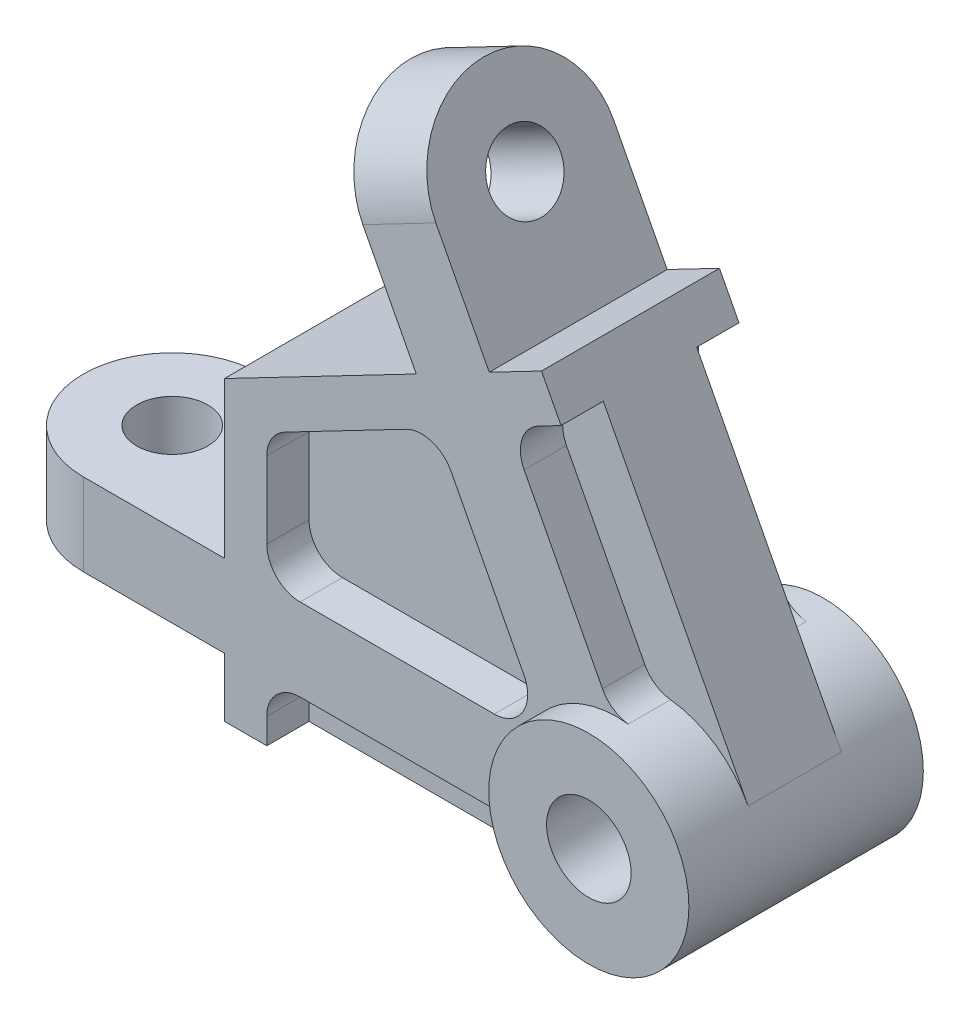
from build123d import *
from build123d.topology import SkipClean

# Parameters (mm, degrees)
BOSS_EXTRU_1_DEPTH      = 20
BOSS_EXTRU_2_DEPTH      = 26.35
BOSS_EXTRU_2_DEPTH_BACK = 26.35
ESQUISSE2_5_R           = 22.5
ESQUISSE2_5_R_2         = 9.5
BOSS_EXTRU_3_DEPTH      = 18.5
BOSS_EXTRU_4_DEPTH      = 18.5
ESQUISSE5_R             = 8
ENL_V_MAT_EXTRU_1_DEPTH = 188.483465609
ESQUISSE6_R             = 8
ENL_V_MAT_EXTRU_2_DEPTH = 190.711724403
ENL_V_START             = -9.5
ENL_V_MAT_EXTRU_3_DEPTH = 9.5


with BuildPart() as part:
    # Esquisse2 → Boss.-Extru.1 (new, symmetric)
    with BuildSketch(Plane.XY):
        with BuildLine():
            Line((-88.25, -22.5), (0, -22.5))
            ThreePointArc((0, -22.5), (-19.23551709, 11.672398309), (19.957743747, 10.389343798))
            Line((19.957743747, 10.389343798), (-16.981934979, 81.349806406))
            Line((-16.981934979, 81.349806406), (-28.734828519, 75.231637281))
            Line((-28.734828519, 75.231637281), (-40.740502796, 98.294322989))
            Line((-40.740502796, 98.294322989), (-57.15020321, 89.751973644))
            Line((-57.15020321, 89.751973644), (-45.144528933, 66.689287936))
            Line((-45.144528933, 66.689287936), (-88.25, 44.25))
            Line((-88.25, 44.25), (-88.25, 9.25))
            Line((-88.25, 9.25), (-120, 9.25))
            Line((-120, 9.25), (-120, -9.25))
            Line((-120, -9.25), (-88.25, -9.25))
            Line((-88.25, -9.25), (-88.25, -22.5))
        make_face()
    extrude(amount=BOSS_EXTRU_1_DEPTH, both=True)

    # Esquisse2<5> → Boss.-Extru.2 (add, two sides: drawn at the far end of the back side and taken through both)
    with BuildSketch(Plane.XY.offset(-BOSS_EXTRU_2_DEPTH_BACK)):
        Circle(ESQUISSE2_5_R)
        Circle(ESQUISSE2_5_R_2, mode=Mode.SUBTRACT)
    extrude(amount=BOSS_EXTRU_2_DEPTH + BOSS_EXTRU_2_DEPTH_BACK)

    # Esquisse3 → Boss.-Extru.3 (add)
    with BuildSketch(Plane.XZ.offset(9.25)):
        with BuildLine():
            Line((-120, 20), (-120, -20))
            ThreePointArc((-120, -20), (-140, 0), (-120, 20))
        make_face()
    extrude(amount=-BOSS_EXTRU_3_DEPTH)

    # Esquisse4 → Boss.-Extru.4 (add)
    with BuildSketch(Plane(origin=(8.204850207, 4.271174672, 0), x_dir=(0, 0, -1), z_dir=(0.8870108331782227, 0.46174861323503186, 0))):
        with BuildLine():
            Line((-20, 106), (20, 106))
            ThreePointArc((20, 106), (0, 126), (-20, 106))
        make_face()
    extrude(amount=-BOSS_EXTRU_4_DEPTH)

    # Esquisse5 → Enlèv. mat.-Extru.1 (cut, through all)
    with BuildSketch(Plane(origin=(8.204850207, 4.271174672, 0), x_dir=(0, 0, -1), z_dir=(0.8870108331782227, 0.46174861323503186, 0))):
        with Locations(Location((0, 106, 0), (0, 0, 90))):
            Circle(ESQUISSE5_R)
    extrude(amount=-ENL_V_MAT_EXTRU_1_DEPTH, mode=Mode.SUBTRACT)

    # Esquisse6 → Enlèv. mat.-Extru.2 (cut, through all)
    with BuildSketch(Plane.XZ.offset(9.25)):
        with Locations((-120, 0)):
            Circle(ESQUISSE6_R)
    extrude(amount=-ENL_V_MAT_EXTRU_2_DEPTH, mode=Mode.SUBTRACT)

    # Esquisse7 → Enlèv. mat.-Extru.3 (cut)
    with SkipClean():  # the faces are left unmerged after this step: merging them gives an invalid solid
        with BuildSketch(Plane.XY.offset(20).offset(ENL_V_START)):
            with BuildLine():
                Line((-17.695635444, 70.268148965), (-12.595323154, 72.923203491))
                Line((-12.595323154, 72.923203491), (19.957743747, 10.389343798))
                ThreePointArc((19.957743747, 10.389343798), (12.734529101, 18.549441193), (2.52390035, 22.3579947))
                ThreePointArc((2.52390035, 22.3579947), (-0.879642567, 23.627512536), (-3.287380782, 26.347545001))
                Line((-3.287380782, 26.347545001), (-20.885102094, 60.152453117))
                ThreePointArc((-20.885102094, 60.152453117), (-21.385397976, 65.870861212), (-17.695635444, 70.268148965))
            make_face()
            with BuildLine():
                Line((-74.713114599, 40.586728011), (-47.410498356, 54.799570422))
                ThreePointArc((-47.410498356, 54.799570422), (-41.69209026, 55.299866303), (-37.294802508, 51.610103772))
                Line((-37.294802508, 51.610103772), (-20.950564458, 20.213114599))
                ThreePointArc((-20.950564458, 20.213114599), (-21.191306677, 12.859200564), (-27.603145707, 9.25))
                Line((-27.603145707, 9.25), (-71.25, 9.25))
                ThreePointArc((-71.25, 9.25), (-76.553300859, 11.446699141), (-78.75, 16.75))
                Line((-78.75, 16.75), (-78.75, 33.934146763))
                ThreePointArc((-78.75, 33.934146763), (-77.66183903, 37.824946199), (-74.713114599, 40.586728011))
            make_face()
            with BuildLine():
                Line((-71.25, -9.25), (-24.888501361, -9.25))
                ThreePointArc((-24.888501361, -9.25), (-21.364033316, -10.129718662), (-18.666376021, -12.5625))
                ThreePointArc((-18.666376021, -12.5625), (-10.573404135, -19.860844015), (0, -22.5))
                Line((0, -22.5), (-78.75, -22.5))
                Line((-78.75, -22.5), (-78.75, -16.75))
                ThreePointArc((-78.75, -16.75), (-76.553300859, -11.446699141), (-71.25, -9.25))
            make_face()
        enl_v_mat_extru_3 = extrude(amount=ENL_V_MAT_EXTRU_3_DEPTH, mode=Mode.SUBTRACT)

    # Symétrie1: Enlèv. mat.-Extru.3 across plane
    add(enl_v_mat_extru_3.mirror(Plane.XY), mode=Mode.SUBTRACT)


solid = part.part
